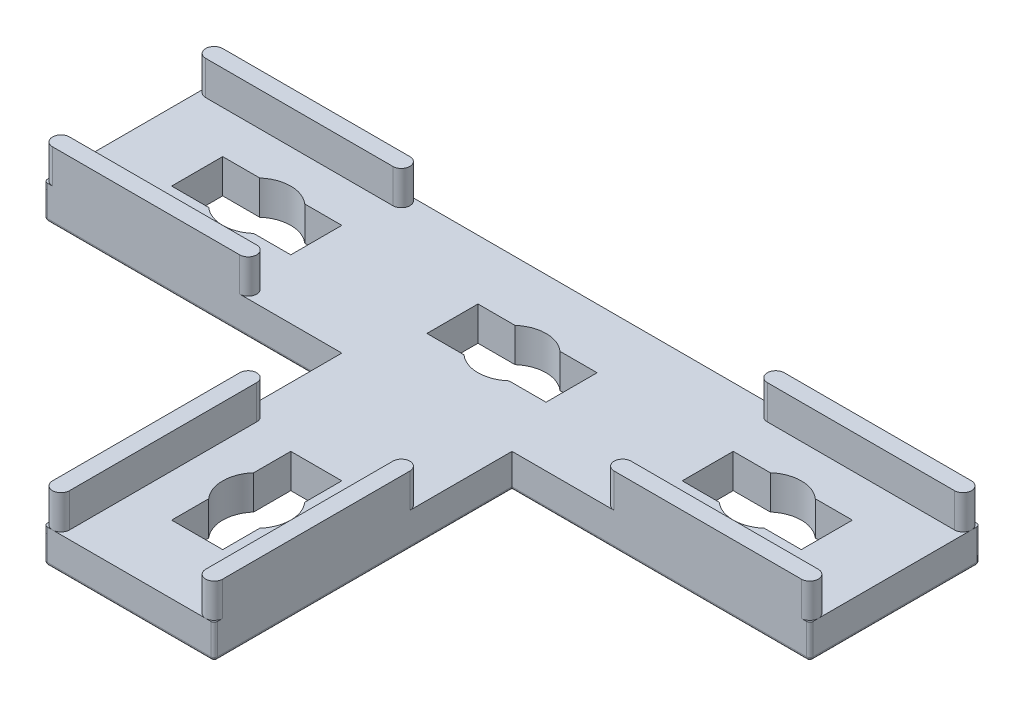
from build123d import *

# Parameters (mm, degrees)
EXTRUDE_1_DEPTH               = 2
EXTRUDE_2_DEPTH               = 2
PATTERN_LINEAR_1_COUNT        = 2
PATTERN_LINEAR_1_PITCH        = 33
PATTERN_LINEAR_1_COPY_1_DEPTH = 2
EXTRUDE_3_DEPTH               = 2
CUT_EXTRUDE_1_REACH           = 33.883
PATTERN_LINEAR_2_COUNT        = 2
PATTERN_LINEAR_2_PITCH        = 15
PATTERN_LINEAR_2_COL_COUNT    = 2
PATTERN_LINEAR_2_COL_PITCH    = 15
CUT_EXTRUDE_2_REACH           = 33.883
FILLET_1_R                    = 0.2


with BuildPart() as part:
    # 草图1 → 凸台-拉伸1 (new body)
    with BuildSketch(Plane(origin=(0, 0, 0), x_dir=(1, 0, 0), z_dir=(0, 1, 0))):
        Polygon((22.5, 5), (22.5, -5), (5, -5), (5, -22.5), (-5, -22.5), (-5, -5), (-22.5, -5), (-22.5, 5), align=None)
    extrude(amount=EXTRUDE_1_DEPTH)

    # 草图2 → 凸台-拉伸2 (add)
    with BuildSketch(Plane(origin=(0, 2, 0), x_dir=(1, 0, 0), z_dir=(0, 1, 0))):
        with BuildLine():
            Line((-22, 4), (-11, 4))
            ThreePointArc((-11, 4), (-10.5, 4.5), (-11, 5))
            Line((-11, 5), (-22, 5))
            ThreePointArc((-22, 5), (-22.5, 4.5), (-22, 4))
        make_face()
    extrude_2 = extrude(amount=EXTRUDE_2_DEPTH)

    # 镜向1: 凸台-拉伸2 across plane
    add(extrude_2.mirror(Plane.XY))

    # 阵列(线性)1: 凸台-拉伸2 ×2
    with Locations(*[(i * PATTERN_LINEAR_1_PITCH, 0, 0) for i in range(1, PATTERN_LINEAR_1_COUNT)]):
        add(extrude_2)

    # 阵列(线性)1 copy 1 sketch → 阵列(线性)1 copy 1 (add)
    with BuildSketch(Plane(origin=(33, 2, 0), x_dir=(1, 0, 0), z_dir=(0, 1, 0))):
        with BuildLine():
            Line((-22, -4), (-11, -4))
            ThreePointArc((-11, -4), (-10.5, -4.5), (-11, -5))
            Line((-11, -5), (-22, -5))
            ThreePointArc((-22, -5), (-22.5, -4.5), (-22, -4))
        make_face()
    extrude(amount=PATTERN_LINEAR_1_COPY_1_DEPTH)

    # 草图3 → 凸台-拉伸3 (add)
    with BuildSketch(Plane(origin=(0, 2, 0), x_dir=(1, 0, 0), z_dir=(0, 1, 0))):
        with BuildLine():
            Line((-4, -22), (-4, -11))
            ThreePointArc((-4, -11), (-4.5, -10.5), (-5, -11))
            Line((-5, -11), (-5, -22))
            ThreePointArc((-5, -22), (-4.5, -22.5), (-4, -22))
        make_face()
    extrude_3 = extrude(amount=EXTRUDE_3_DEPTH)

    # 镜向2: 凸台-拉伸3 across plane
    add(extrude_3.mirror(Plane(origin=(0, 0, 0), x_dir=(0, 0, 1), z_dir=(1, 0, 0))))

    # 草图4 → 切除-拉伸1 (cut, up to next)
    with BuildSketch(Plane(origin=(0, 2, 0), x_dir=(1, 0, 0), z_dir=(0, 1, 0)), mode=Mode.PRIVATE) as cut_extrude_1_sk1:
        with BuildLine():
            Line((3.5, 1.5), (3.5, -1.5))
            Line((3.5, -1.5), (1.322875656, -1.5))
            ThreePointArc((1.322875656, -1.5), (0, -2), (-1.322875656, -1.5))
            Line((-1.322875656, -1.5), (-3.5, -1.5))
            Line((-3.5, -1.5), (-3.5, 1.5))
            Line((-3.5, 1.5), (-1.322875656, 1.5))
            ThreePointArc((-1.322875656, 1.5), (0, 2), (1.322875656, 1.5))
            Line((1.322875656, 1.5), (3.5, 1.5))
        make_face()
    cut_extrude_1_tool1 = extrude(cut_extrude_1_sk1.sketch, amount=-CUT_EXTRUDE_1_REACH, mode=Mode.PRIVATE) & part.part
    cut_extrude_1 = cut_extrude_1_tool1.solids().sort_by_distance((0, 2, 0))[0]
    add(cut_extrude_1, mode=Mode.SUBTRACT)

    # 阵列(线性)2: 切除-拉伸1 ×2
    with Locations(*[(i * PATTERN_LINEAR_2_PITCH, 0, 0) for i in range(1, PATTERN_LINEAR_2_COUNT)]):
        add(cut_extrude_1, mode=Mode.SUBTRACT)

    # 阵列(线性)2 col: 切除-拉伸1 ×2
    with Locations(*[(-i * PATTERN_LINEAR_2_COL_PITCH, 0, 0) for i in range(1, PATTERN_LINEAR_2_COL_COUNT)]):
        add(cut_extrude_1, mode=Mode.SUBTRACT)

    # 草图5 → 切除-拉伸2 (cut, up to next)
    with BuildSketch(Plane(origin=(0, 2, 0), x_dir=(1, 0, 0), z_dir=(0, 1, 0)), mode=Mode.PRIVATE) as cut_extrude_2_sk1:
        with BuildLine():
            Line((1.5, -11.5), (-1.5, -11.5))
            Line((-1.5, -11.5), (-1.5, -13.677124344))
            ThreePointArc((-1.5, -13.677124344), (-2, -15), (-1.5, -16.322875656))
            Line((-1.5, -16.322875656), (-1.5, -18.5))
            Line((-1.5, -18.5), (1.5, -18.5))
            Line((1.5, -18.5), (1.5, -16.322875656))
            ThreePointArc((1.5, -16.322875656), (2, -15), (1.5, -13.677124344))
            Line((1.5, -13.677124344), (1.5, -11.5))
        make_face()
    cut_extrude_2_tool1 = extrude(cut_extrude_2_sk1.sketch, amount=-CUT_EXTRUDE_2_REACH, mode=Mode.PRIVATE) & part.part
    add(cut_extrude_2_tool1.solids().sort_by_distance((0, 2, 15))[0], mode=Mode.SUBTRACT)

    # 圆角1
    fillet_1_edges = [part.edges().sort_by_distance(p)[0] for p in [
        (22.5, 1, 5),
        (22.5, 1, -5),
        (-22.5, 1, -5),
        (-22.5, 1, 5),
        (5, 1, 22.5),
        (-5, 1, 22.5),
        (-22.5, 0, 0),
        (22.5, 0, 0),
        (0, 0, 22.5),
        (5, 0, 13.75),
        (-5, 0, 13.75),
        (-13.75, 0, 5),
        (13.75, 0, 5),
        (0, 0, -5),
    ]]
    fillet(fillet_1_edges, radius=FILLET_1_R)


solid = part.part
